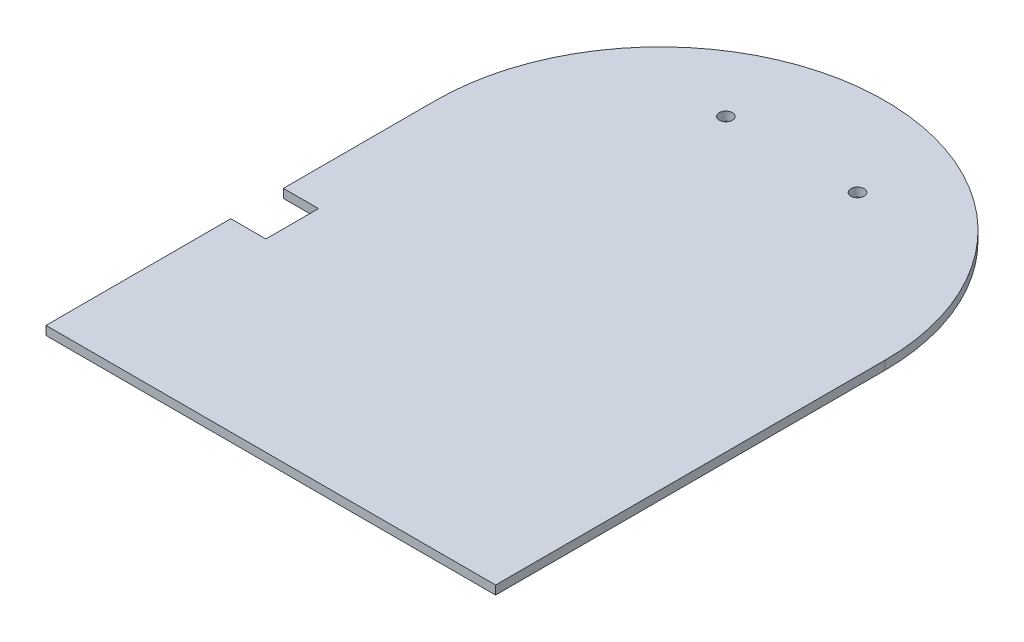
from build123d import *

# Parameters (mm, degrees)
BOSS_EXTRU_1_DEPTH      = 2
ESQUISSE4_R             = 1.5
ENL_V_MAT_EXTRU_1_DEPTH = 10


with BuildPart() as part:
    # Esquisse1 → Boss.-Extru.1 (new body)
    with BuildSketch(Plane(origin=(0, 0, 0), x_dir=(1, 0, 0), z_dir=(0, 1, 0))):
        with BuildLine():
            Line((-51.25, 0), (-51.25, -34.62957381))
            Line((-51.25, -34.62957381), (-43.25, -34.62957381))
            Line((-43.25, -34.62957381), (-43.25, -46.62957381))
            Line((-43.25, -46.62957381), (-51.25, -46.62957381))
            Line((-51.25, -46.62957381), (-51.25, -88.75))
            Line((-51.25, -88.75), (51.25, -88.75))
            Line((51.25, -88.75), (51.25, 0))
            ThreePointArc((51.25, 0), (0, 51.25), (-51.25, 0))
        make_face()
    extrude(amount=BOSS_EXTRU_1_DEPTH)

    # Esquisse4 → Enlèv. mat.-Extru.1 (cut)
    with BuildSketch(Plane(origin=(0, 2, 0), x_dir=(1, 0, 0), z_dir=(0, 1, 0))):
        with Locations(Location((15, 30, 0), (0, 0, 270))):
            Circle(ESQUISSE4_R)
        with Locations(Location((-15, 30, 0), (0, 0, 270))):
            Circle(ESQUISSE4_R)
    extrude(amount=-ENL_V_MAT_EXTRU_1_DEPTH, mode=Mode.SUBTRACT)


solid = part.part
